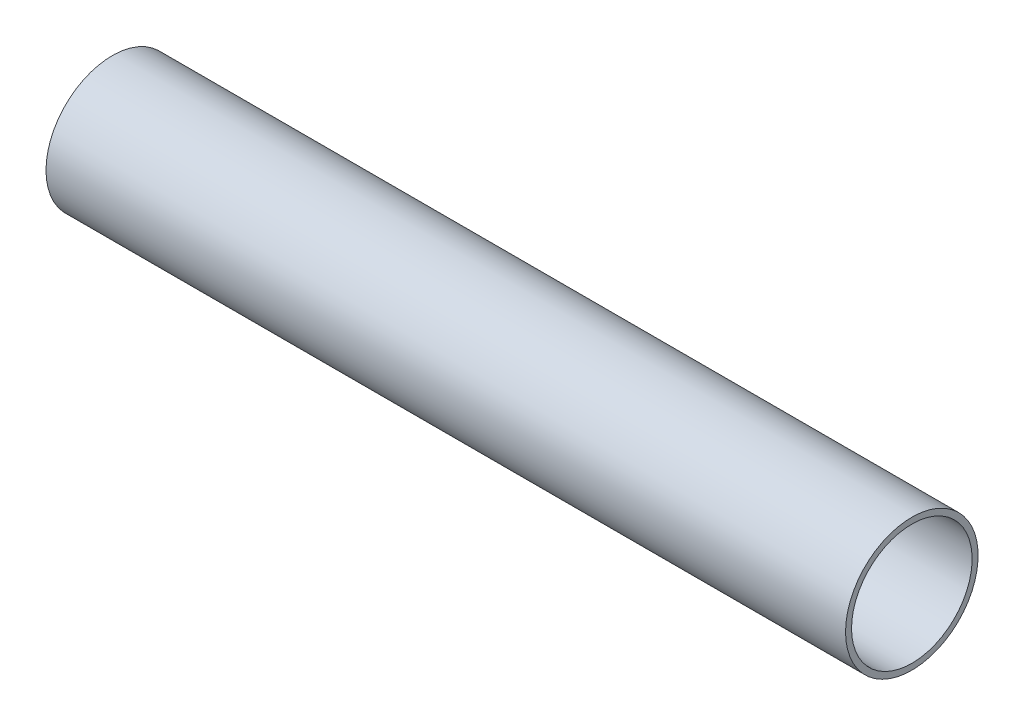
from build123d import *

# Parameters (mm, degrees)
SKETCH1_R           = 12.6365
SKETCH1_R_2         = 11.4935
BOSS_EXTRUDE1_DEPTH = 76.2


with BuildPart() as part:
    # Sketch1 → Boss-Extrude1 (new, symmetric)
    with BuildSketch(Plane(origin=(0, 0, 0), x_dir=(0, 0, -1), z_dir=(1, 0, 0))):
        with Locations(Location((0, 0, 0), (0, 0, 180))):
            Circle(SKETCH1_R)
        with Locations(Location((0, 0, 0), (0, 0, 180))):
            Circle(SKETCH1_R_2, mode=Mode.SUBTRACT)
    extrude(amount=BOSS_EXTRUDE1_DEPTH, both=True)


solid = part.part
